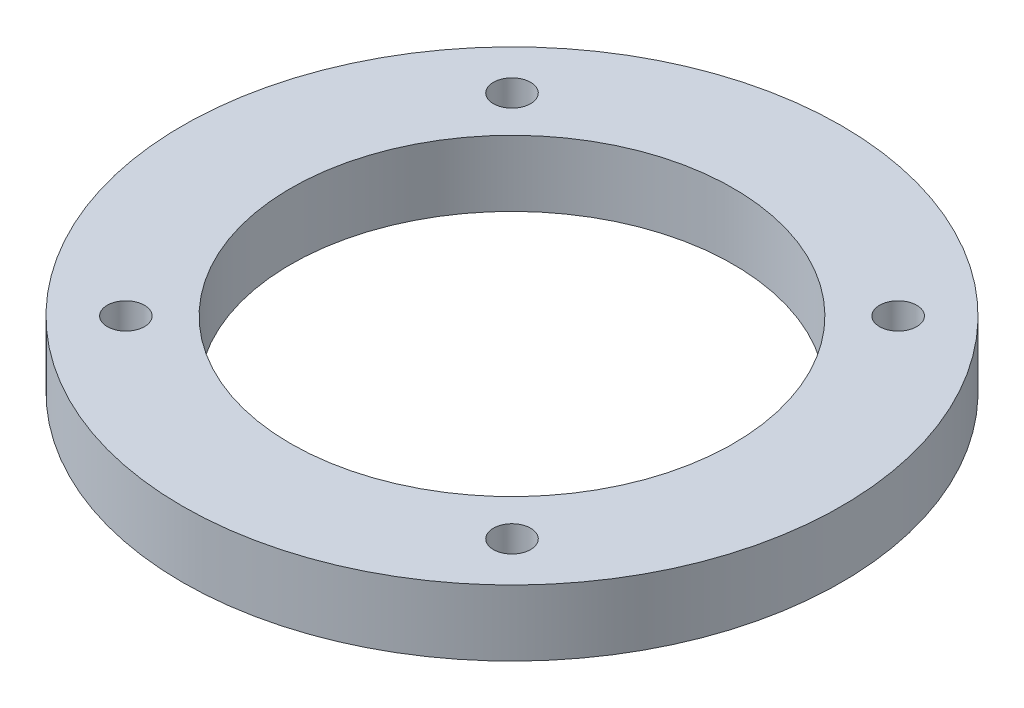
from build123d import *

# Parameters (mm, degrees)
SKETCH2_R           = 35
SKETCH2_R_2         = 23.5
SKETCH2_R_3         = 1.975
BOSS_EXTRUDE1_DEPTH = 7


with BuildPart() as part:
    # Sketch2 → Boss-Extrude1 (new body)
    with BuildSketch(Plane(origin=(0, 0, 0), x_dir=(1, 0, 0), z_dir=(0, 1, 0))):
        with Locations(Location((0, 0, 0), (0, 0, 270))):
            Circle(SKETCH2_R)
        with Locations(Location((0, 0, 0), (0, 0, 270))):
            Circle(SKETCH2_R_2, mode=Mode.SUBTRACT)
        with Locations(Location((20.505, 20.505, 0), (0, 0, 270))):
            Circle(SKETCH2_R_3, mode=Mode.SUBTRACT)
        with Locations(Location((-20.505, 20.505, 0), (0, 0, 90))):
            Circle(SKETCH2_R_3, mode=Mode.SUBTRACT)
        with Locations(Location((20.505, -20.505, 0), (0, 0, 90))):
            Circle(SKETCH2_R_3, mode=Mode.SUBTRACT)
        with Locations(Location((-20.505, -20.505, 0), (0, 0, 270))):
            Circle(SKETCH2_R_3, mode=Mode.SUBTRACT)
    extrude(amount=BOSS_EXTRUDE1_DEPTH)


solid = part.part
